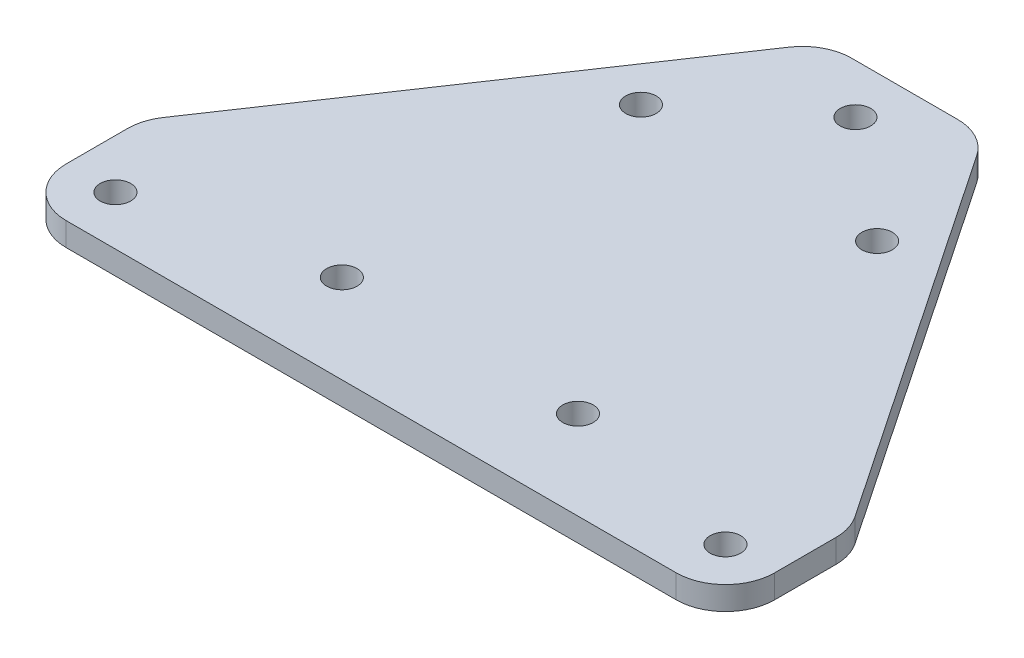
from build123d import *

# Parameters (mm, degrees)
SKETCH1_R           = 1.55
BOSS_EXTRUDE1_DEPTH = 2.38


with BuildPart() as part:
    # Sketch1 → Boss-Extrude1 (new body)
    with BuildSketch(Plane(origin=(0, 0, 0), x_dir=(1, 0, 0), z_dir=(0, 1, 0))):
        with BuildLine():
            Line((-5.394574785, 30), (5.394574785, 30))
            ThreePointArc((5.394574785, 30), (7.742669354, 29.414346146), (9.54069567, 27.794580758))
            Line((9.54069567, 27.794580758), (35.146120884, -10.194369075))
            ThreePointArc((35.146120884, -10.194369075), (35.781767687, -11.527889331), (36, -12.988949833))
            Line((36, -12.988949833), (36, -19.215381939))
            ThreePointArc((36, -19.215381939), (34.535533906, -22.750915845), (31, -24.215381939))
            Line((31, -24.215381939), (-31, -24.215381939))
            ThreePointArc((-31, -24.215381939), (-34.535533906, -22.750915845), (-36, -19.215381939))
            Line((-36, -19.215381939), (-36, -12.988949833))
            ThreePointArc((-36, -12.988949833), (-35.781767687, -11.527889331), (-35.146120884, -10.194369075))
            Line((-35.146120884, -10.194369075), (-9.54069567, 27.794580758))
            ThreePointArc((-9.54069567, 27.794580758), (-7.742669354, 29.414346146), (-5.394574785, 30))
        make_face()
        with Locations(Location((0, 25, 0), (0, 0, 270))):
            Circle(SKETCH1_R, mode=Mode.SUBTRACT)
        with Locations(Location((-31, -19.215381939, 0), (0, 0, 270))):
            Circle(SKETCH1_R, mode=Mode.SUBTRACT)
        with Locations(Location((31, -19.215381939, 0), (0, 0, 270))):
            Circle(SKETCH1_R, mode=Mode.SUBTRACT)
        with Locations(Location((12, -15.2, 0), (0, 0, 270))):
            Circle(SKETCH1_R, mode=Mode.SUBTRACT)
        with Locations(Location((-12, -15.2, 0), (0, 0, 270))):
            Circle(SKETCH1_R, mode=Mode.SUBTRACT)
        with Locations(Location((-12, 15.2, 0), (0, 0, 270))):
            Circle(SKETCH1_R, mode=Mode.SUBTRACT)
        with Locations(Location((12, 15.2, 0), (0, 0, 270))):
            Circle(SKETCH1_R, mode=Mode.SUBTRACT)
    extrude(amount=BOSS_EXTRUDE1_DEPTH)


solid = part.part
